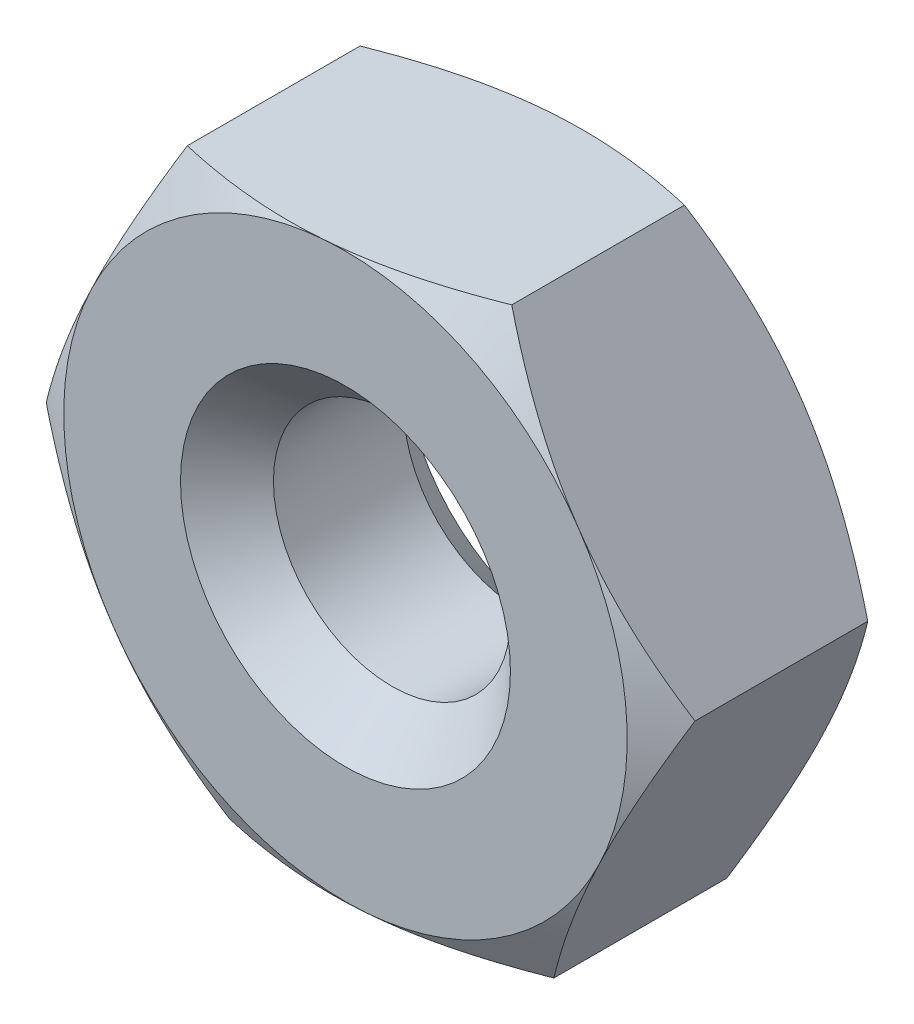
from build123d import *

# Parameters (mm, degrees)
SKICA1_R                = 1.275
P_IDAT_VYSUNUT_M1_DEPTH = 2.4
ZKOSEN_1_SIZE           = 0.5


with BuildPart() as part:
    # Skica1 → Přidat vysunutím1 (new body)
    with BuildSketch(Plane.XY):
        Polygon((1.517935358, 3.153707699), (-1.972223305, 2.89142443), (-3.490158662, -0.262283268), (-1.517935358, -3.153707699), (1.972223305, -2.89142443), (3.490158662, 0.262283268), align=None)
        Circle(SKICA1_R, mode=Mode.SUBTRACT)
    extrude(amount=P_IDAT_VYSUNUT_M1_DEPTH)

    # Zkosení1
    zkosen_1_edges = [part.edges().sort_by_distance(p)[0] for p in [
        (-1.275, 0, 0),
        (-1.275, 0, 2.4),
    ]]
    chamfer(zkosen_1_edges, length=ZKOSEN_1_SIZE)

    # Skica3 → Odebrat rotací1 (revolve, cut)
    with BuildSketch(Plane(origin=(0, 0, 0), x_dir=(0.9010593425374666, -0.43369581647273064, 0), z_dir=(0.43369581647273064, 0.9010593425374666, 0))):
        Polygon((-5.109549882, 0), (-5.109549882, -1.2), (-3.031088913, 0), align=None)
        Polygon((-5.109549882, -2.4), (-3.031088913, -2.4), (-5.109549882, -1.2), align=None)
    revolve(axis=Axis((0, 0, 2.4), (0, 0, 1)), mode=Mode.SUBTRACT)


solid = part.part
